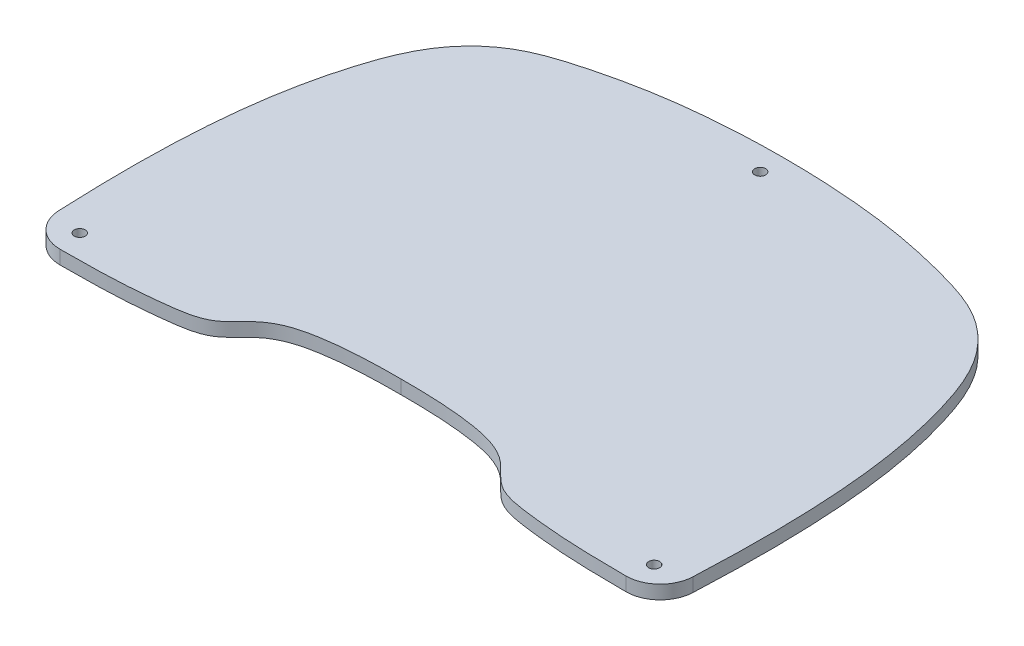
from build123d import *

# Parameters (mm, degrees)
SKETCH1_W           = 240
SKETCH1_H           = 310
BOSS_EXTRUDE1_DEPTH = 4
CUT_EXTRUDE1_REACH  = 198.064
SKETCH2_R           = 1.75
CUT_EXTRUDE2_REACH  = 198.064
SKETCH3_R           = 1.75
FILLET3_R           = 3
SKETCH4_R           = 1.6
CUT_EXTRUDE3_DEPTH  = 5
FILLET4_R           = 10
SKETCH5_R           = 1.6
CUT_EXTRUDE4_DEPTH  = 168.426582877


with BuildPart() as part:
    # Sketch1 → Boss-Extrude1 (new body)
    with BuildSketch(Plane(origin=(0, 0, 0), x_dir=(1, 0, 0), z_dir=(0, 1, 0))):
        Rectangle(SKETCH1_W, SKETCH1_H)
    extrude(amount=BOSS_EXTRUDE1_DEPTH)

    # Sketch2 → Cut-Extrude1 (cut, up to next)
    with BuildSketch(Plane(origin=(0, 4, 0), x_dir=(1, 0, 0), z_dir=(0, 1, 0)), mode=Mode.PRIVATE) as cut_extrude1_sk1:
        with BuildLine():
            Line((-120, 155), (-120, 0))
            add(Edge.make_bspline(
                [(0, 155), (-30.572222193, 155), (-80.343316982, 153.733320995), (-119.221157946, 117.654395612), (-120, 45.41001223), (-120, 0)],
                knots=[0, 0, 0, 0, 0.458017491, 0.558017491, 1, 1, 1, 1], degree=3))
            Line((0, 155), (-120, 155))
        make_face()
    cut_extrude1_tool1 = extrude(cut_extrude1_sk1.sketch, amount=-CUT_EXTRUDE1_REACH, mode=Mode.PRIVATE) & part.part
    # Sketch2 → Cut-Extrude1 (cut, up to next)
    with BuildSketch(Plane(origin=(0, 4, 0), x_dir=(1, 0, 0), z_dir=(0, 1, 0)), mode=Mode.PRIVATE) as cut_extrude1_sk2:
        with BuildLine():
            add(Edge.make_bspline(
                [(0, 155), (30.572222193, 155), (80.343316982, 153.733320995), (119.221157946, 117.654395612), (120, 45.41001223), (120, 0)],
                knots=[0, 0, 0, 0, 0.458017491, 0.558017491, 1, 1, 1, 1], degree=3))
            Line((120, 0), (120, 155))
            Line((120, 155), (0, 155))
        make_face()
    cut_extrude1_tool2 = extrude(cut_extrude1_sk2.sketch, amount=-CUT_EXTRUDE1_REACH, mode=Mode.PRIVATE) & part.part
    # Sketch2 → Cut-Extrude1 (cut, up to next)
    with BuildSketch(Plane(origin=(0, 4, 0), x_dir=(1, 0, 0), z_dir=(0, 1, 0)), mode=Mode.PRIVATE) as cut_extrude1_sk3:
        with BuildLine():
            Line((120, -155), (120, 0))
            add(Edge.make_bspline(
                [(0, -155), (30.572222193, -155), (80.343316982, -153.733320995), (119.221157946, -117.654395612), (120, -45.41001223), (120, 0)],
                knots=[0, 0, 0, 0, 0.458017491, 0.558017491, 1, 1, 1, 1], degree=3))
            Line((0, -155), (120, -155))
        make_face()
    cut_extrude1_tool3 = extrude(cut_extrude1_sk3.sketch, amount=-CUT_EXTRUDE1_REACH, mode=Mode.PRIVATE) & part.part
    # Sketch2 → Cut-Extrude1 (cut, up to next)
    with BuildSketch(Plane(origin=(0, 4, 0), x_dir=(1, 0, 0), z_dir=(0, 1, 0)), mode=Mode.PRIVATE) as cut_extrude1_sk4:
        with BuildLine():
            add(Edge.make_bspline(
                [(0, -155), (-30.572222193, -155), (-80.343316982, -153.733320995), (-119.221157946, -117.654395612), (-120, -45.41001223), (-120, 0)],
                knots=[0, 0, 0, 0, 0.458017491, 0.558017491, 1, 1, 1, 1], degree=3))
            Line((-120, 0), (-120, -155))
            Line((-120, -155), (0, -155))
        make_face()
    cut_extrude1_tool4 = extrude(cut_extrude1_sk4.sketch, amount=-CUT_EXTRUDE1_REACH, mode=Mode.PRIVATE) & part.part
    # Sketch2 → Cut-Extrude1 (cut, up to next)
    with BuildSketch(Plane(origin=(0, 4, 0), x_dir=(1, 0, 0), z_dir=(0, 1, 0)), mode=Mode.PRIVATE) as cut_extrude1_sk5:
        with Locations(Location((-88.957037006, 132.338171163, 0), (0, 0, 270))):
            Circle(SKETCH2_R)
    cut_extrude1_tool5 = extrude(cut_extrude1_sk5.sketch, amount=-CUT_EXTRUDE1_REACH, mode=Mode.PRIVATE) & part.part
    # Sketch2 → Cut-Extrude1 (cut, up to next)
    with BuildSketch(Plane(origin=(0, 4, 0), x_dir=(1, 0, 0), z_dir=(0, 1, 0)), mode=Mode.PRIVATE) as cut_extrude1_sk6:
        with Locations(Location((0, 146, 0), (0, 0, 270))):
            Circle(SKETCH2_R)
    cut_extrude1_tool6 = extrude(cut_extrude1_sk6.sketch, amount=-CUT_EXTRUDE1_REACH, mode=Mode.PRIVATE) & part.part
    # Sketch2 → Cut-Extrude1 (cut, up to next)
    with BuildSketch(Plane(origin=(0, 4, 0), x_dir=(1, 0, 0), z_dir=(0, 1, 0)), mode=Mode.PRIVATE) as cut_extrude1_sk7:
        with Locations(Location((88.957037006, 132.338171163, 0), (0, 0, 270))):
            Circle(SKETCH2_R)
    cut_extrude1_tool7 = extrude(cut_extrude1_sk7.sketch, amount=-CUT_EXTRUDE1_REACH, mode=Mode.PRIVATE) & part.part
    # Sketch2 → Cut-Extrude1 (cut, up to next)
    with BuildSketch(Plane(origin=(0, 4, 0), x_dir=(1, 0, 0), z_dir=(0, 1, 0)), mode=Mode.PRIVATE) as cut_extrude1_sk8:
        with Locations(Location((-110.418476952, 44.934472183, 0), (0, 0, 270))):
            Circle(SKETCH2_R)
    cut_extrude1_tool8 = extrude(cut_extrude1_sk8.sketch, amount=-CUT_EXTRUDE1_REACH, mode=Mode.PRIVATE) & part.part
    # Sketch2 → Cut-Extrude1 (cut, up to next)
    with BuildSketch(Plane(origin=(0, 4, 0), x_dir=(1, 0, 0), z_dir=(0, 1, 0)), mode=Mode.PRIVATE) as cut_extrude1_sk9:
        with Locations(Location((-49, -30, 0), (0, 0, 270))):
            Circle(SKETCH2_R)
    cut_extrude1_tool9 = extrude(cut_extrude1_sk9.sketch, amount=-CUT_EXTRUDE1_REACH, mode=Mode.PRIVATE) & part.part
    # Sketch2 → Cut-Extrude1 (cut, up to next)
    with BuildSketch(Plane(origin=(0, 4, 0), x_dir=(1, 0, 0), z_dir=(0, 1, 0)), mode=Mode.PRIVATE) as cut_extrude1_sk10:
        with Locations(Location((49, -30, 0), (0, 0, 270))):
            Circle(SKETCH2_R)
    cut_extrude1_tool10 = extrude(cut_extrude1_sk10.sketch, amount=-CUT_EXTRUDE1_REACH, mode=Mode.PRIVATE) & part.part
    # Sketch2 → Cut-Extrude1 (cut, up to next)
    with BuildSketch(Plane(origin=(0, 4, 0), x_dir=(1, 0, 0), z_dir=(0, 1, 0)), mode=Mode.PRIVATE) as cut_extrude1_sk11:
        with Locations(Location((-88.957037006, -132.338171163, 0), (0, 0, 270))):
            Circle(SKETCH2_R)
    cut_extrude1_tool11 = extrude(cut_extrude1_sk11.sketch, amount=-CUT_EXTRUDE1_REACH, mode=Mode.PRIVATE) & part.part
    # Sketch2 → Cut-Extrude1 (cut, up to next)
    with BuildSketch(Plane(origin=(0, 4, 0), x_dir=(1, 0, 0), z_dir=(0, 1, 0)), mode=Mode.PRIVATE) as cut_extrude1_sk12:
        with Locations(Location((0, -146, 0), (0, 0, 270))):
            Circle(SKETCH2_R)
    cut_extrude1_tool12 = extrude(cut_extrude1_sk12.sketch, amount=-CUT_EXTRUDE1_REACH, mode=Mode.PRIVATE) & part.part
    # Sketch2 → Cut-Extrude1 (cut, up to next)
    with BuildSketch(Plane(origin=(0, 4, 0), x_dir=(1, 0, 0), z_dir=(0, 1, 0)), mode=Mode.PRIVATE) as cut_extrude1_sk13:
        with Locations(Location((88.957037006, -132.338171163, 0), (0, 0, 270))):
            Circle(SKETCH2_R)
    cut_extrude1_tool13 = extrude(cut_extrude1_sk13.sketch, amount=-CUT_EXTRUDE1_REACH, mode=Mode.PRIVATE) & part.part
    # Sketch2 → Cut-Extrude1 (cut, up to next)
    with BuildSketch(Plane(origin=(0, 4, 0), x_dir=(1, 0, 0), z_dir=(0, 1, 0)), mode=Mode.PRIVATE) as cut_extrude1_sk14:
        with Locations(Location((110.418476952, 44.934472183, 0), (0, 0, 270))):
            Circle(SKETCH2_R)
    cut_extrude1_tool14 = extrude(cut_extrude1_sk14.sketch, amount=-CUT_EXTRUDE1_REACH, mode=Mode.PRIVATE) & part.part
    add(cut_extrude1_tool1.solids().sort_by_distance((-102.173006, 4, -133.115769))[0], mode=Mode.SUBTRACT)
    add(cut_extrude1_tool2.solids().sort_by_distance((102.087926, 4, -133.133004))[0], mode=Mode.SUBTRACT)
    add(cut_extrude1_tool3.solids().sort_by_distance((102.087926, 4, 133.133004))[0], mode=Mode.SUBTRACT)
    add(cut_extrude1_tool4.solids().sort_by_distance((-102.173006, 4, 133.115769))[0], mode=Mode.SUBTRACT)
    add(cut_extrude1_tool5.solids().sort_by_distance((-88.957037, 4, -132.338171))[0], mode=Mode.SUBTRACT)
    add(cut_extrude1_tool6.solids().sort_by_distance((0, 4, -146))[0], mode=Mode.SUBTRACT)
    add(cut_extrude1_tool7.solids().sort_by_distance((88.957037, 4, -132.338171))[0], mode=Mode.SUBTRACT)
    add(cut_extrude1_tool8.solids().sort_by_distance((-110.418477, 4, -44.934472))[0], mode=Mode.SUBTRACT)
    add(cut_extrude1_tool9.solids().sort_by_distance((-49, 4, 30))[0], mode=Mode.SUBTRACT)
    add(cut_extrude1_tool10.solids().sort_by_distance((49, 4, 30))[0], mode=Mode.SUBTRACT)
    add(cut_extrude1_tool11.solids().sort_by_distance((-88.957037, 4, 132.338171))[0], mode=Mode.SUBTRACT)
    add(cut_extrude1_tool12.solids().sort_by_distance((0, 4, 146))[0], mode=Mode.SUBTRACT)
    add(cut_extrude1_tool13.solids().sort_by_distance((88.957037, 4, 132.338171))[0], mode=Mode.SUBTRACT)
    add(cut_extrude1_tool14.solids().sort_by_distance((110.418477, 4, -44.934472))[0], mode=Mode.SUBTRACT)

    # Sketch3 → Cut-Extrude2 (cut, up to next)
    with BuildSketch(Plane(origin=(0, 4, 0), x_dir=(1, 0, 0), z_dir=(0, 1, 0)), mode=Mode.PRIVATE) as cut_extrude2_sk1:
        with BuildLine():
            Line((-120, 0), (120, 0))
            add(Edge.make_bspline(
                [(0, -155), (30.572222193, -155), (80.343316982, -153.733320995), (119.221157946, -117.654395612), (120, -45.41001223), (120, 0)],
                knots=[0, 0, 0, 0, 0.458017491, 0.558017491, 1, 1, 1, 1], degree=3))
            add(Edge.make_bspline(
                [(-120, 0), (-120, -45.41001223), (-119.221157946, -117.654395612), (-80.343316982, -153.733320995), (-30.572222193, -155), (0, -155)],
                knots=[0, 0, 0, 0, 0.441982509, 0.541982509, 1, 1, 1, 1], degree=3))
        make_face()
        with Locations((88.957037006, -132.338171163)):
            Circle(SKETCH3_R, mode=Mode.SUBTRACT)
        with Locations((49, -30)):
            Circle(SKETCH3_R, mode=Mode.SUBTRACT)
        with Locations((-88.957037006, -132.338171163)):
            Circle(SKETCH3_R, mode=Mode.SUBTRACT)
        with Locations((-49, -30)):
            Circle(SKETCH3_R, mode=Mode.SUBTRACT)
        with Locations((0, -146)):
            Circle(SKETCH3_R, mode=Mode.SUBTRACT)
    cut_extrude2_tool1 = extrude(cut_extrude2_sk1.sketch, amount=-CUT_EXTRUDE2_REACH, mode=Mode.PRIVATE) & part.part
    # Sketch3 → Cut-Extrude2 (cut, up to next)
    with BuildSketch(Plane(origin=(0, 4, 0), x_dir=(1, 0, 0), z_dir=(0, 1, 0)), mode=Mode.PRIVATE) as cut_extrude2_sk2:
        with BuildLine():
            add(Edge.make_bspline(
                [(-119.996868981, 5), (-119.999161826, 3.317063079), (-120, 1.649620662), (-120, 0)],
                knots=[0.983943993, 0.983943993, 0.983943993, 0.983943993, 1, 1, 1, 1], degree=3))
            Line((-120, 0), (120, 0))
            add(Edge.make_bspline(
                [(120, 0), (120, 1.649620662), (119.999161826, 3.317063079), (119.996868981, 5)],
                knots=[0, 0, 0, 0, 0.016056007, 0.016056007, 0.016056007, 0.016056007], degree=3))
            Line((119.996868981, 5), (-119.996868981, 5))
        make_face()
    cut_extrude2_tool2 = extrude(cut_extrude2_sk2.sketch, amount=-CUT_EXTRUDE2_REACH, mode=Mode.PRIVATE) & part.part
    add(cut_extrude2_tool1.solids().sort_by_distance((0, 4, 73.058016))[0], mode=Mode.SUBTRACT)
    add(cut_extrude2_tool2.solids().sort_by_distance((0, 4, -2.499989))[0], mode=Mode.SUBTRACT)

    # Fillet3
    fillet3_edges = [part.edges().sort_by_distance(p)[0] for p in [
        (119.996868981, 2, -5),
        (-119.996868981, 2, -5),
    ]]
    fillet(fillet3_edges, radius=FILLET3_R)

    # Sketch4 → Cut-Extrude3 (cut)
    # profile 1 of 2: a face of its own
    with BuildSketch(Plane(origin=(0, 4, 0), x_dir=(1, 0, 0), z_dir=(0, 1, 0))):
        with BuildLine():
            ThreePointArc((-119.991132673, 8.007468224), (-119.115101087, 5.881321718), (-116.991141968, 5))
            Line((-116.991141968, 5), (116.991141968, 5))
            ThreePointArc((116.991141968, 5), (119.115101087, 5.881321718), (119.991132673, 8.007468224))
            add(Edge.make_bspline(
                [(0, 155), (30.572222193, 155), (80.343316982, 153.733320995), (118.227056859, 118.576928811), (119.881344424, 52.109482017), (119.991132673, 8.007468224)],
                knots=[0, 0, 0, 0, 0.458017491, 0.558017491, 0.974430136, 0.974430136, 0.974430136, 0.974430136], degree=3))
            add(Edge.make_bspline(
                [(0, 155), (-30.572222193, 155), (-80.343316982, 153.733320995), (-118.227056859, 118.576928811), (-119.881344424, 52.109482017), (-119.991132673, 8.007468224)],
                knots=[0, 0, 0, 0, 0.458017491, 0.558017491, 0.974430136, 0.974430136, 0.974430136, 0.974430136], degree=3))
        make_face()
        with BuildLine():
            add(Edge.make_bspline(
                [(-92.233514507, 10), (-80.664301387, 10), (-67.379754657, 9.832976348), (-50.821281342, 11.756445914), (-41.687640008, 13.092793482), (-34.61054209, 23.0328201), (-19.157922754, 26.773253881), (-6.717349602, 27), (0, 27)],
                knots=[0, 0, 0, 0, 0.354854857, 0.417368962, 0.525089505, 0.626100692, 0.774450144, 1, 1, 1, 1], degree=3))
            add(Edge.make_bspline(
                [(-92.233514507, 10), (-93.109031306, 24.461653993), (-94.141297679, 55.929427893), (-89.848799736, 89.042535108), (-82.77661836, 109.219212766), (-77.505758875, 118.879248593), (-67.56067431, 127.964233668), (-51.20251433, 133.204450958), (-28.956327731, 138.000468293), (-10.500871466, 139), (0, 139)],
                knots=[0.048683265, 0.048683265, 0.048683265, 0.048683265, 0.273512027, 0.499348708, 0.541604418, 0.589205488, 0.661188988, 0.734095029, 0.840040992, 1, 1, 1, 1], degree=3))
            add(Edge.make_bspline(
                [(92.233514507, 10), (93.109031306, 24.461653993), (94.141297679, 55.929427893), (89.848799736, 89.042535108), (82.77661836, 109.219212766), (77.505758875, 118.879248593), (67.56067431, 127.964233668), (51.20251433, 133.204450958), (28.956327731, 138.000468293), (10.500871466, 139), (0, 139)],
                knots=[0.048683265, 0.048683265, 0.048683265, 0.048683265, 0.273512027, 0.499348708, 0.541604418, 0.589205488, 0.661188988, 0.734095029, 0.840040992, 1, 1, 1, 1], degree=3))
            add(Edge.make_bspline(
                [(92.233514507, 10), (80.664301387, 10), (67.379754657, 9.832976348), (50.821281342, 11.756445914), (41.687640008, 13.092793482), (34.61054209, 23.0328201), (19.157922754, 26.773253881), (6.717349602, 27), (0, 27)],
                knots=[0, 0, 0, 0, 0.354854857, 0.417368962, 0.525089505, 0.626100692, 0.774450144, 1, 1, 1, 1], degree=3))
        make_face(mode=Mode.SUBTRACT)
    # profile 2 of 2: a face of its own
    with BuildSketch(Plane(origin=(0, 4, 0), x_dir=(1, 0, 0), z_dir=(0, 1, 0))):
        with Locations(Location((0, 132, 0), (0, 0, 270))):
            Circle(SKETCH4_R)
    extrude(amount=-CUT_EXTRUDE3_DEPTH, mode=Mode.SUBTRACT)

    # Fillet4
    fillet4_edges = [part.edges().sort_by_distance(p)[0] for p in [
        (92.233514507, 2, -10),
        (-92.233514507, 2, -10),
    ]]
    fillet(fillet4_edges, radius=FILLET4_R)

    # Sketch5 → Cut-Extrude4 (cut, through all)
    with BuildSketch(Plane(origin=(0, 4, 0), x_dir=(1, 0, 0), z_dir=(0, 1, 0))):
        with Locations(Location((-84, 17, 0), (0, 0, 270))):
            Circle(SKETCH5_R)
        with Locations(Location((84, 17, 0), (0, 0, 270))):
            Circle(SKETCH5_R)
    extrude(amount=-CUT_EXTRUDE4_DEPTH, mode=Mode.SUBTRACT)


solid = part.part
